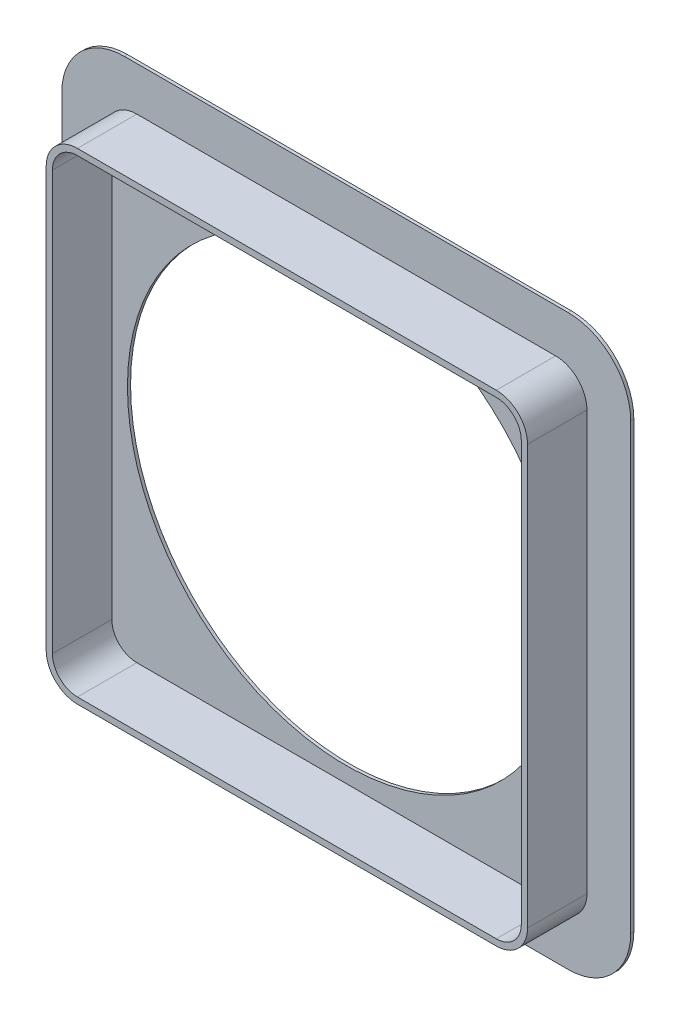
from build123d import *

# Parameters (mm, degrees)
SKETCH1_W           = 91
SKETCH1_H           = 91
BOSS_EXTRUDE1_DEPTH = 0.5
SKETCH2_W           = 77
SKETCH2_H           = 77
BOSS_EXTRUDE2_DEPTH = 10
FILLET1_R           = 5
CUT_EXTRUDE1_DEPTH  = 66.119121616
FILLET2_R           = 10
BOSS_EXTRUDE3_START = 0.5
SKETCH7_R           = 35
BOSS_EXTRUDE3_DEPTH = 0.5


with BuildPart() as part:
    # Sketch1 → Boss-Extrude1 (new body)
    with BuildSketch(Plane.XY):
        Rectangle(SKETCH1_W, SKETCH1_H)
    extrude(amount=BOSS_EXTRUDE1_DEPTH)

    # Sketch2 → Boss-Extrude2 (add)
    with BuildSketch(Plane.XY):
        Rectangle(SKETCH2_W, SKETCH2_H)
    extrude(amount=BOSS_EXTRUDE2_DEPTH)

    # Fillet1
    fillet1_edges = [part.edges().sort_by_distance(p)[0] for p in [
        (38.5, -38.5, 5.25),
        (38.5, 38.5, 5.25),
        (-38.5, 38.5, 5.25),
        (-38.5, -38.5, 5.25),
    ]]
    fillet(fillet1_edges, radius=FILLET1_R)

    # Sketch4 → Cut-Extrude1 (cut, through all)
    with BuildSketch(Plane.XY.offset(10)):
        with BuildLine():
            Line((-33.5, -37.5), (33.5, -37.5))
            ThreePointArc((33.5, -37.5), (36.328427125, -36.328427125), (37.5, -33.5))
            Line((37.5, -33.5), (37.5, 33.5))
            ThreePointArc((37.5, 33.5), (36.328427125, 36.328427125), (33.5, 37.5))
            Line((33.5, 37.5), (-33.5, 37.5))
            ThreePointArc((-33.5, 37.5), (-36.328427125, 36.328427125), (-37.5, 33.5))
            Line((-37.5, 33.5), (-37.5, -33.5))
            ThreePointArc((-37.5, -33.5), (-36.328427125, -36.328427125), (-33.5, -37.5))
        make_face()
    extrude(amount=-CUT_EXTRUDE1_DEPTH, mode=Mode.SUBTRACT)

    # Fillet2
    fillet2_edges = [part.edges().sort_by_distance(p)[0] for p in [
        (45.5, -45.5, 0.25),
        (-45.5, -45.5, 0.25),
        (-45.5, 45.5, 0.25),
        (45.5, 45.5, 0.25),
    ]]
    fillet(fillet2_edges, radius=FILLET2_R)

    # Sketch7 → Boss-Extrude3 (add)
    with BuildSketch(Plane.XY.offset(BOSS_EXTRUDE3_START)):
        with BuildLine():
            Line((-33.5, -37.5), (33.5, -37.5))
            ThreePointArc((33.5, -37.5), (36.328427125, -36.328427125), (37.5, -33.5))
            Line((37.5, -33.5), (37.5, 33.5))
            ThreePointArc((37.5, 33.5), (36.328427125, 36.328427125), (33.5, 37.5))
            Line((33.5, 37.5), (-33.5, 37.5))
            ThreePointArc((-33.5, 37.5), (-36.328427125, 36.328427125), (-37.5, 33.5))
            Line((-37.5, 33.5), (-37.5, -33.5))
            ThreePointArc((-37.5, -33.5), (-36.328427125, -36.328427125), (-33.5, -37.5))
        make_face()
        with Locations(Location((0, 0, 0), (0, 0, 180))):
            Circle(SKETCH7_R, mode=Mode.SUBTRACT)
    extrude(amount=-BOSS_EXTRUDE3_DEPTH)


solid = part.part
